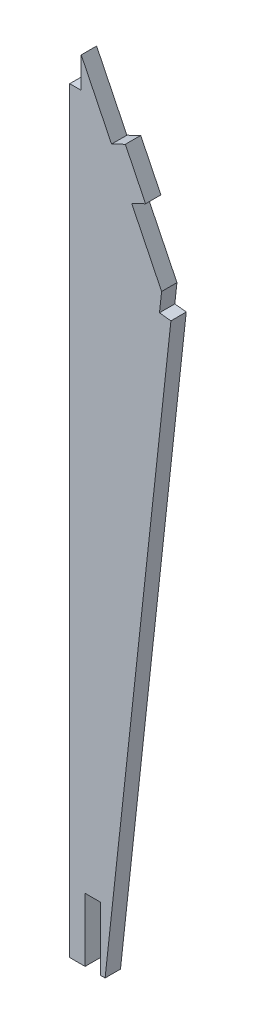
from build123d import *

# Parameters (mm, degrees)
EXTRUDE_1_DEPTH = 2


with BuildPart() as part:
    # 草图1 → 凸台-拉伸1 (new body)
    with BuildSketch(Plane.XY):
        Polygon((28.324638032, 81.911544994), (29.815754259, 81.748534571), (21.245650557, 3.354647285), (20.63861269, 3.354647285), (20.63861269, 11.604647285), (18.63861269, 11.604647285), (18.63861269, 3.354647285), (16.63861269, 3.354647285), (16.63861269, 101.903905963), (18.13861269, 101.903905963), (18.13861269, 105.903905963), (22.083953011, 97.814759547), (23.881541104, 98.69150184), (26.511767984, 93.298737563), (24.714179892, 92.421995269), (28.60218807, 84.450397166), align=None)
    extrude(amount=EXTRUDE_1_DEPTH)


solid = part.part
